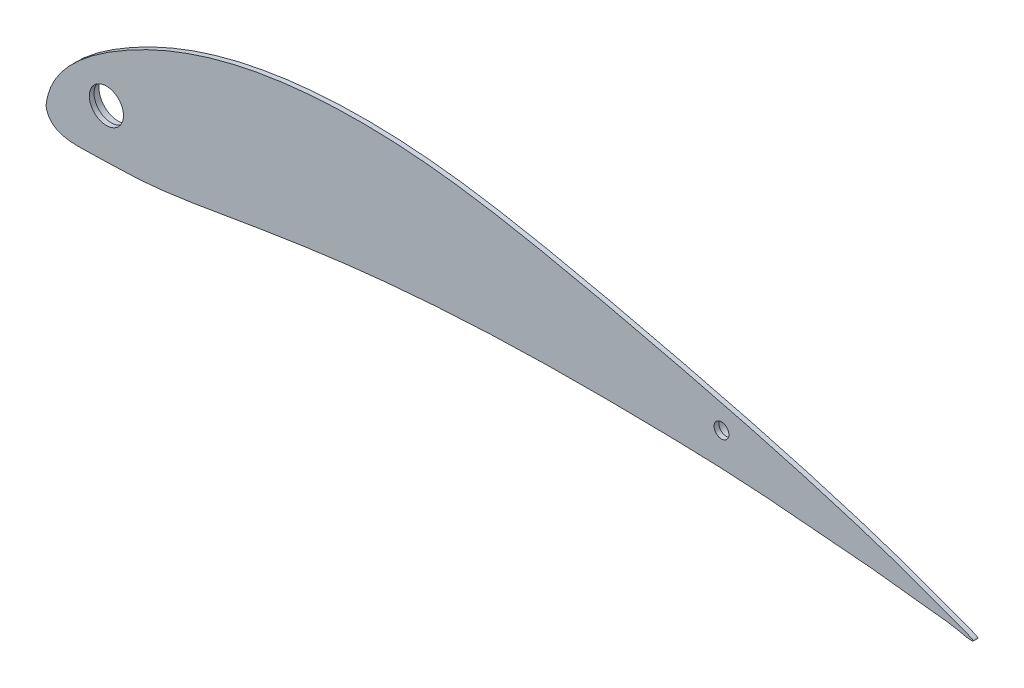
from build123d import *

# Parameters (mm, degrees)
BOSS_EXTRUDE1_DEPTH = 1.5875
SKETCH2_R           = 8
SKETCH2_R_2         = 6.5
SKETCH2_R_3         = 4.5
SKETCH2_R_4         = 3
BOSS_EXTRUDE2_DEPTH = 4
SKETCH2_4_R         = 5.75
SKETCH2_4_R_2       = 2.5
CUT_EXTRUDE1_DEPTH  = 4


with BuildPart() as part:
    # Sketch1 → Boss-Extrude1 (new body)
    with BuildSketch(Plane.XY):
        with BuildLine():
            add(Edge.make_bspline(
                [(0.000560351, 0.000130087), (0.810633127, 7.359196055), (8.649092025, 17.856605174), (26.286719818, 29.975176328), (52.111128271, 42.069215275), (89.597618475, 49.290763054), (131.400792109, 47.884831915), (173.256699242, 40.041104278), (217.961060472, 29.612974894), (256.952064401, 19.528920948), (290.35983767, 8.71099439), (301.273197721, 4.382828139), (314.816918223, -0.516206742), (309.846313895, 0.000130087)],
                knots=[0, 0, 0, 0, 0.060863618, 0.113688265, 0.188608742, 0.312908923, 0.448482434, 0.557612135, 0.691544113, 0.852438279, 0.92975597, 0.976058229, 1, 1, 1, 1], degree=3))
            add(Edge.make_bspline(
                [(309.846313895, 0.000130087), (303.956832565, 1.47095521), (293.989507544, 2.093987313), (276.26402299, 4.514356704), (260.846344817, 5.427413394), (235.858814759, 7.870306192), (205.101424636, 8.838080282), (157.718638092, 9.030650149), (110.497331172, 6.181495223), (66.506197185, -0.586669107), (36.454672816, -6.098499901), (15.316603331, -6.189065841), (1.230714189, -6.924076091), (0.000560351, 0.000130087)],
                knots=[0, 0, 0, 0, 0.057787081, 0.095274891, 0.171021118, 0.205339302, 0.335319146, 0.464904334, 0.658702312, 0.785511947, 0.893517288, 0.94309214, 1, 1, 1, 1], degree=3))
        make_face()
    extrude(amount=BOSS_EXTRUDE1_DEPTH)

    # Sketch2 → Boss-Extrude2 (add)
    # profile 1 of 2: a face of its own
    with BuildSketch(Plane.XY.offset(1.5875)):
        with Locations((20.32, 10.16)):
            Circle(SKETCH2_R)
        with Locations((20.32, 10.16)):
            Circle(SKETCH2_R_2, mode=Mode.SUBTRACT)
    # profile 2 of 2: a face of its own
    with BuildSketch(Plane.XY.offset(1.5875)):
        with Locations((227.296313895, 19.050130087)):
            Circle(SKETCH2_R_3)
        with Locations((227.296313895, 19.050130087)):
            Circle(SKETCH2_R_4, mode=Mode.SUBTRACT)
    extrude(amount=-BOSS_EXTRUDE2_DEPTH)

    # Sketch2<4> → Cut-Extrude1 (cut)
    with BuildSketch(Plane.XY.offset(1.5875)):
        with Locations((20.32, 10.16)):
            Circle(SKETCH2_4_R)
        with Locations((227.296313895, 19.050130087)):
            Circle(SKETCH2_4_R_2)
    extrude(amount=-CUT_EXTRUDE1_DEPTH, mode=Mode.SUBTRACT)


solid = part.part
